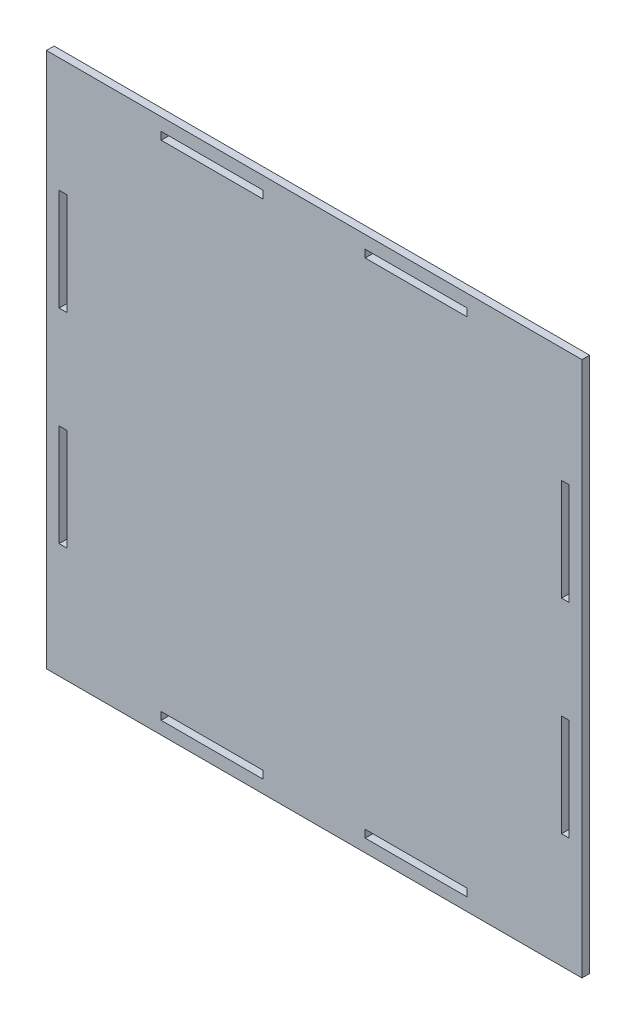
from build123d import *

# Parameters (mm, degrees)
SKETCH_1_W      = 200
SKETCH_1_H      = 5
EXTRUDE_1_DEPTH = 3


with BuildPart() as part:
    # 草图1 → 凸台-拉伸1 (new body)
    with BuildSketch(Plane.XY):
        Polygon((0, -80), (0, -100), (100, -100), (100, 0), (80, 0), (80, -3), (40, -3), (40, 0), (0, 0), (0, -40), (3, -40), (3, -80), align=None)
        Polygon((100, -100), (0, -100), (0, -120), (3, -120), (3, -160), (0, -160), (0, -200), (40, -200), (40, -197), (80, -197), (80, -200), (100, -200), align=None)
        Polygon((100, 0), (100, -100), (200, -100), (200, -80), (197, -80), (197, -40), (200, -40), (200, 0), (160, 0), (160, -3), (120, -3), (120, 0), align=None)
        Polygon((200, -100), (100, -100), (100, -200), (120, -200), (120, -197), (160, -197), (160, -200), (200, -200), (200, -160), (197, -160), (197, -120), (200, -120), align=None)
        Polygon((-5, -205), (-5, 5), (0, 5), (0, 0), (0, -200), (0, -205), align=None)
        with Locations((100, 2.5)):
            Rectangle(SKETCH_1_W, SKETCH_1_H)
        Polygon((205, 5), (205, -200), (200, -200), (200, 0), (200, 5), align=None)
        Polygon((0, -200), (200, -200), (205, -200), (205, -205), (0, -205), align=None)
    extrude(amount=EXTRUDE_1_DEPTH)


solid = part.part
